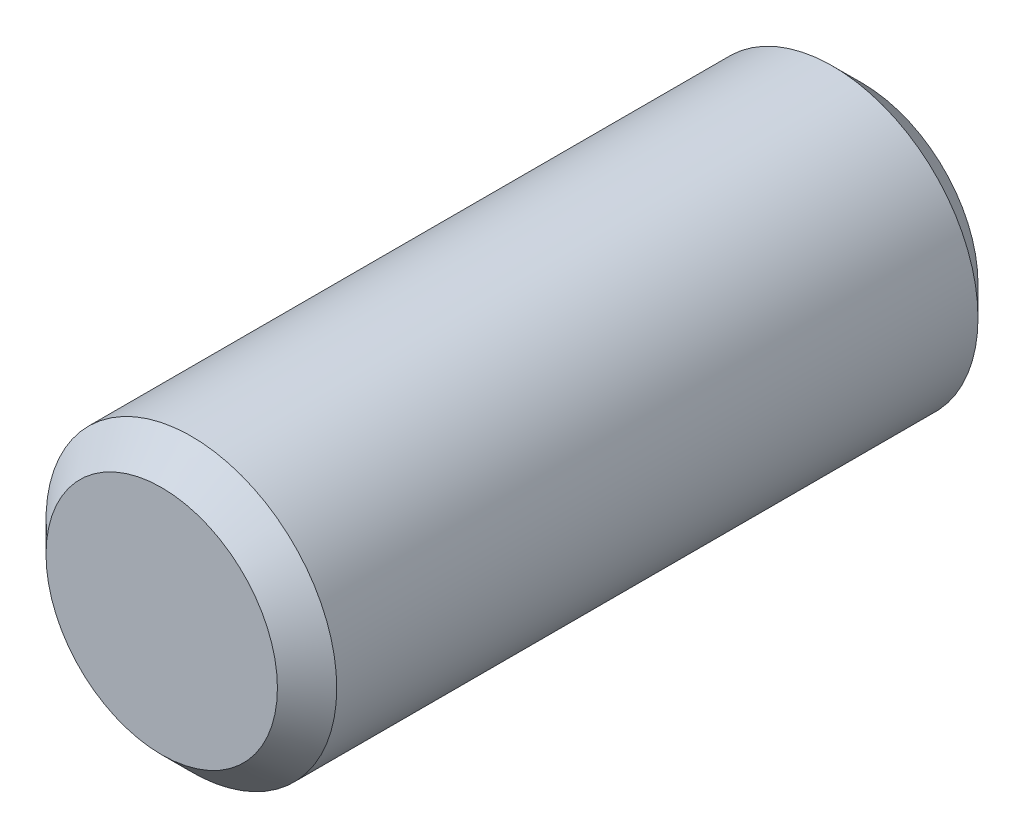
from build123d import *

# Parameters (mm, degrees)
SKETCH1_R      = 2.49
EXTRUDE1_DEPTH = 12
CHAMFER1_SIZE  = 0.508


with BuildPart() as part:
    # Sketch1 → Extrude1 (new body)
    with BuildSketch(Plane.XY):
        Circle(SKETCH1_R)
    extrude(amount=EXTRUDE1_DEPTH)

    # Chamfer1
    chamfer1_edges = [part.edges().sort_by_distance(p)[0] for p in [
        (-2.49, 0, 0),
        (-2.49, 0, 12),
    ]]
    chamfer(chamfer1_edges, length=CHAMFER1_SIZE)


solid = part.part
